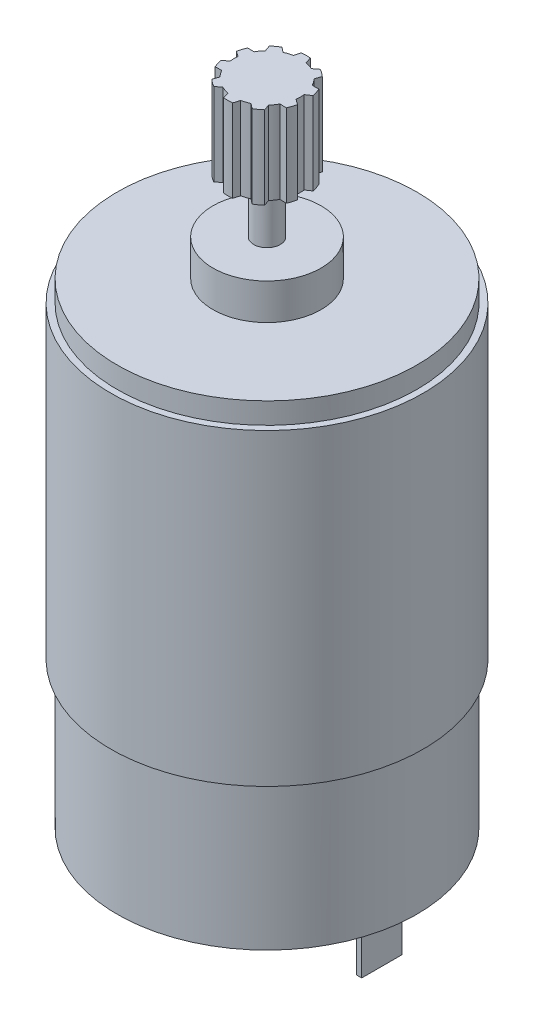
from build123d import *

# Parameters (mm, degrees)
SKETCH4_W           = 17.9705
SKETCH4_H           = 57.023
SKETCH4_W_2         = 1.5875
SKETCH4_H_2         = 16.51
BOSS_EXTRUDE3_DEPTH = 9.906
SKETCH6_W           = 0.762
SKETCH6_H           = 36.957
REVOLVE2_ANGLE      = 345
SKETCH8_W           = 0.635
SKETCH8_H           = 4.826
BOSS_EXTRUDE4_DEPTH = 6.985


with BuildPart() as part:
    # Sketch4 → Revolve1 (revolve)
    with BuildSketch(Plane(origin=(0, 0, 0), x_dir=(0, 0, -1), z_dir=(1, 0, 0))):
        with Locations((8.98525, 28.5115)):
            Rectangle(SKETCH4_W, SKETCH4_H)
        Polygon((0, 61.341), (0, 57.023), (6.477, 57.023), (6.477, 61.341), (1.5875, 61.341), align=None)
        with Locations((0.79375, 69.596)):
            Rectangle(SKETCH4_W_2, SKETCH4_H_2)
    revolve(axis=Axis((0, -9.179219972, 0), (0, 1, 0)))

    # Sketch5 → Boss-Extrude3 (add)
    # profile 1 of 12: a face of its own
    with BuildSketch(Plane(origin=(0, 77.851, 0), x_dir=(1, 0, 0), z_dir=(0, 1, 0))):
        with BuildLine():
            ThreePointArc((-2.91443478, 2.721877799), (-2.343970029, 3.22619797), (-1.688049741, 3.612898686))
            Line((-1.688049741, 3.612898686), (-2.300310076, 4.082888836))
            ThreePointArc((-2.300310076, 4.082888836), (-2.754538028, 3.791296341), (-3.172223127, 3.449406923))
            Line((-3.172223127, 3.449406923), (-2.91443478, 2.721877799))
        make_face()
    # profile 2 of 12: a face of its own
    with BuildSketch(Plane(origin=(0, 77.851, 0), x_dir=(1, 0, 0), z_dir=(0, 1, 0))):
        with BuildLine():
            Line((0, 4.6863), (0, 3.9878))
            ThreePointArc((0, 3.9878), (0.380712775, 3.969585195), (0.757947638, 3.915107178))
            Line((0.757947638, 3.915107178), (0.538871901, 4.655214793))
            ThreePointArc((0.538871901, 4.655214793), (0.269883871, 4.678522244), (0, 4.6863))
        make_face()
    # profile 3 of 12: a face of its own
    with BuildSketch(Plane(origin=(0, 77.851, 0), x_dir=(1, 0, 0), z_dir=(0, 1, 0))):
        with BuildLine():
            Line((-0.538871901, 4.655214793), (-0.757947638, 3.915107178))
            ThreePointArc((-0.757947638, 3.915107178), (-0.380712775, 3.969585195), (0, 3.9878))
            Line((0, 3.9878), (0, 4.6863))
            Line((0, 4.6863), (-0.538871901, 4.655214793))
        make_face()
    # profile 4 of 12: a face of its own
    with BuildSketch(Plane(origin=(0, 77.851, 0), x_dir=(1, 0, 0), z_dir=(0, 1, 0))):
        with BuildLine():
            Line((2.300310076, 4.082888836), (1.688049741, 3.612898686))
            ThreePointArc((1.688049741, 3.612898686), (2.343970029, 3.22619797), (2.91443478, 2.721877799))
            Line((2.91443478, 2.721877799), (3.172223127, 3.449406923))
            ThreePointArc((3.172223127, 3.449406923), (2.754538028, 3.791296341), (2.300310076, 4.082888836))
        make_face()
    # profile 5 of 12: a face of its own
    with BuildSketch(Plane(origin=(0, 77.851, 0), x_dir=(1, 0, 0), z_dir=(0, 1, 0))):
        with BuildLine():
            Line((4.260851788, 1.951038116), (3.489269493, 1.930685693))
            ThreePointArc((3.489269493, 1.930685693), (3.792623176, 1.23229797), (3.957706895, 0.488983613))
            Line((3.957706895, 0.488983613), (4.593892938, 0.926042851))
            ThreePointArc((4.593892938, 0.926042851), (4.456936152, 1.448146341), (4.260851788, 1.951038116))
        make_face()
    # profile 6 of 12: a face of its own
    with BuildSketch(Plane(origin=(0, 77.851, 0), x_dir=(1, 0, 0), z_dir=(0, 1, 0))):
        with BuildLine():
            Line((4.593892938, -0.926042851), (3.957706895, -0.488983613))
            ThreePointArc((3.957706895, -0.488983613), (3.792623176, -1.23229797), (3.489269493, -1.930685693))
            Line((3.489269493, -1.930685693), (4.260851788, -1.951038116))
            ThreePointArc((4.260851788, -1.951038116), (4.456936152, -1.448146341), (4.593892938, -0.926042851))
        make_face()
    # profile 7 of 12: a face of its own
    with BuildSketch(Plane(origin=(0, 77.851, 0), x_dir=(1, 0, 0), z_dir=(0, 1, 0))):
        with BuildLine():
            Line((3.172223127, -3.449406923), (2.91443478, -2.721877799))
            ThreePointArc((2.91443478, -2.721877799), (2.343970029, -3.22619797), (1.688049741, -3.612898686))
            Line((1.688049741, -3.612898686), (2.300310076, -4.082888836))
            ThreePointArc((2.300310076, -4.082888836), (2.754538028, -3.791296341), (3.172223127, -3.449406923))
        make_face()
    # profile 8 of 12: a face of its own
    with BuildSketch(Plane(origin=(0, 77.851, 0), x_dir=(1, 0, 0), z_dir=(0, 1, 0))):
        with BuildLine():
            ThreePointArc((0.757947638, -3.915107178), (0, -3.9878), (-0.757947638, -3.915107178))
            Line((-0.757947638, -3.915107178), (-0.538871901, -4.655214793))
            ThreePointArc((-0.538871901, -4.655214793), (0, -4.6863), (0.538871901, -4.655214793))
            Line((0.538871901, -4.655214793), (0.757947638, -3.915107178))
        make_face()
    # profile 9 of 12: a face of its own
    with BuildSketch(Plane(origin=(0, 77.851, 0), x_dir=(1, 0, 0), z_dir=(0, 1, 0))):
        with BuildLine():
            ThreePointArc((-1.688049741, -3.612898686), (-2.343970029, -3.22619797), (-2.91443478, -2.721877799))
            Line((-2.91443478, -2.721877799), (-3.172223127, -3.449406923))
            ThreePointArc((-3.172223127, -3.449406923), (-2.754538028, -3.791296341), (-2.300310076, -4.082888836))
            Line((-2.300310076, -4.082888836), (-1.688049741, -3.612898686))
        make_face()
    # profile 10 of 12: a face of its own
    with BuildSketch(Plane(origin=(0, 77.851, 0), x_dir=(1, 0, 0), z_dir=(0, 1, 0))):
        with BuildLine():
            ThreePointArc((-3.489269493, -1.930685693), (-3.792623176, -1.23229797), (-3.957706895, -0.488983613))
            Line((-3.957706895, -0.488983613), (-4.593892938, -0.926042851))
            ThreePointArc((-4.593892938, -0.926042851), (-4.456936152, -1.448146341), (-4.260851788, -1.951038116))
            Line((-4.260851788, -1.951038116), (-3.489269493, -1.930685693))
        make_face()
    # profile 11 of 12: a face of its own
    with BuildSketch(Plane(origin=(0, 77.851, 0), x_dir=(1, 0, 0), z_dir=(0, 1, 0))):
        with BuildLine():
            ThreePointArc((-3.957706895, 0.488983613), (-3.792623176, 1.23229797), (-3.489269493, 1.930685693))
            Line((-3.489269493, 1.930685693), (-4.260851788, 1.951038116))
            ThreePointArc((-4.260851788, 1.951038116), (-4.456936152, 1.448146341), (-4.593892938, 0.926042851))
            Line((-4.593892938, 0.926042851), (-3.957706895, 0.488983613))
        make_face()
    # profile 12 of 12: a face of its own
    with BuildSketch(Plane(origin=(0, 77.851, 0), x_dir=(1, 0, 0), z_dir=(0, 1, 0))):
        with BuildLine():
            ThreePointArc((0, 3.9878), (-0.380712775, 3.969585195), (-0.757947638, 3.915107178))
            ThreePointArc((-0.757947638, 3.915107178), (-1.23229797, 3.792623176), (-1.688049741, 3.612898686))
            ThreePointArc((-1.688049741, 3.612898686), (-2.343970029, 3.22619797), (-2.91443478, 2.721877799))
            ThreePointArc((-2.91443478, 2.721877799), (-3.22619797, 2.343970029), (-3.489269493, 1.930685693))
            ThreePointArc((-3.489269493, 1.930685693), (-3.792623176, 1.23229797), (-3.957706895, 0.488983613))
            ThreePointArc((-3.957706895, 0.488983613), (-3.9878, 0), (-3.957706895, -0.488983613))
            ThreePointArc((-3.957706895, -0.488983613), (-3.792623176, -1.23229797), (-3.489269493, -1.930685693))
            ThreePointArc((-3.489269493, -1.930685693), (-3.22619797, -2.343970029), (-2.91443478, -2.721877799))
            ThreePointArc((-2.91443478, -2.721877799), (-2.343970029, -3.22619797), (-1.688049741, -3.612898686))
            ThreePointArc((-1.688049741, -3.612898686), (-1.23229797, -3.792623176), (-0.757947638, -3.915107178))
            ThreePointArc((-0.757947638, -3.915107178), (0, -3.9878), (0.757947638, -3.915107178))
            ThreePointArc((0.757947638, -3.915107178), (1.23229797, -3.792623176), (1.688049741, -3.612898686))
            ThreePointArc((1.688049741, -3.612898686), (2.343970029, -3.22619797), (2.91443478, -2.721877799))
            ThreePointArc((2.91443478, -2.721877799), (3.22619797, -2.343970029), (3.489269493, -1.930685693))
            ThreePointArc((3.489269493, -1.930685693), (3.792623176, -1.23229797), (3.957706895, -0.488983613))
            ThreePointArc((3.957706895, -0.488983613), (3.980269614, -0.244954368), (3.9878, 0))
            ThreePointArc((3.9878, 0), (3.980269614, 0.244954368), (3.957706895, 0.488983613))
            ThreePointArc((3.957706895, 0.488983613), (3.792623176, 1.23229797), (3.489269493, 1.930685693))
            ThreePointArc((3.489269493, 1.930685693), (3.22619797, 2.343970029), (2.91443478, 2.721877799))
            ThreePointArc((2.91443478, 2.721877799), (2.343970029, 3.22619797), (1.688049741, 3.612898686))
            ThreePointArc((1.688049741, 3.612898686), (1.23229797, 3.792623176), (0.757947638, 3.915107178))
            ThreePointArc((0.757947638, 3.915107178), (0.380712775, 3.969585195), (0, 3.9878))
        make_face()
        with BuildLine():
            ThreePointArc((0, -1.5875), (-1.5875, 0), (0, 1.5875))
            ThreePointArc((0, 1.5875), (1.122532015, 1.122532015), (1.5875, 0))
            ThreePointArc((1.5875, 0), (1.122532015, -1.122532015), (0, -1.5875))
        make_face(mode=Mode.SUBTRACT)
    extrude(amount=-BOSS_EXTRUDE3_DEPTH)

    # Sketch6 → Revolve2 (revolve)
    with BuildSketch(Plane(origin=(0, 0, 0), x_dir=(0, 0, -1), z_dir=(1, 0, 0))):
        with Locations((18.3515, 36.0045)):
            Rectangle(SKETCH6_W, SKETCH6_H)
    revolve(axis=Axis((0, 0, 0), (0, 1, 0)), revolution_arc=REVOLVE2_ANGLE)

    # Sketch8 → Boss-Extrude4 (add)
    with BuildSketch(Plane.XZ):
        with Locations((-13.97, 0.523045405)):
            Rectangle(SKETCH8_W, SKETCH8_H)
        with Locations((13.97, 0.523045405)):
            Rectangle(SKETCH8_W, SKETCH8_H)
    extrude(amount=BOSS_EXTRUDE4_DEPTH)


solid = part.part
